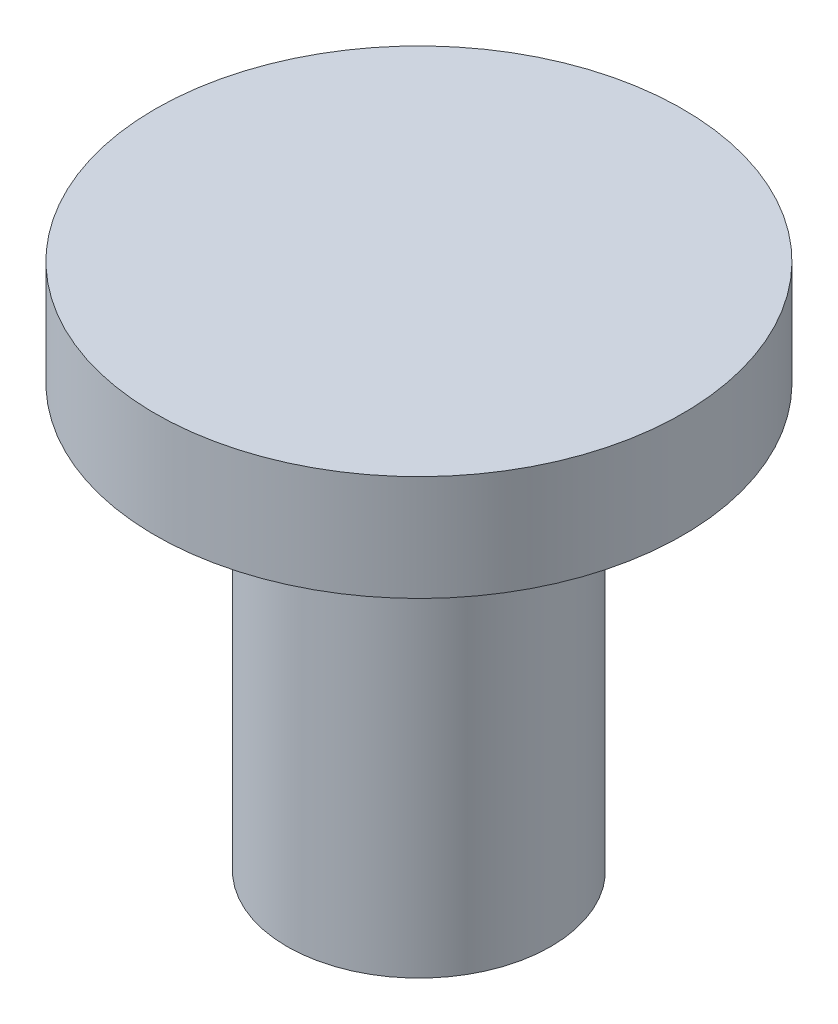
from build123d import *


with BuildPart() as part:
    # Sketch1 → Revolve1 (revolve)
    with BuildSketch(Plane.XY, mode=Mode.PRIVATE) as revolve1_sk:
        Polygon((0, 0), (0, -6.35), (1.5875, -6.35), (1.5875, -1.27), (3.175, -1.27), (3.175, 0), align=None)
    revolve(revolve1_sk.sketch.rotate(Axis((0, 0, 0), (0, -1, 0)), 180), axis=Axis((0, 0, 0), (0, -1, 0)))


solid = part.part
